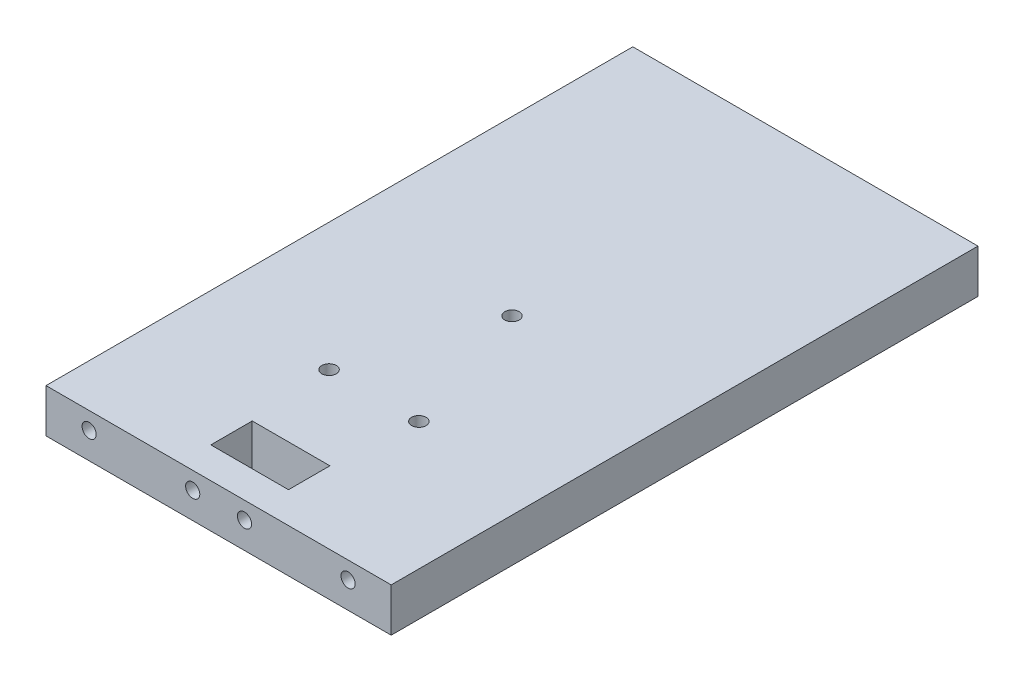
from build123d import *

# Parameters (mm, degrees)
SKETCH1_R           = 2.05
BOSS_EXTRUDE1_DEPTH = 170
BOSS_EXTRUDE3_START = 10
SKETCH1_3_R         = 2.05
BOSS_EXTRUDE3_DEPTH = 151
SKETCH3_R           = 2.1
SKETCH3_W           = 22.5
SKETCH3_H           = 12
CUT_EXTRUDE1_DEPTH  = 178.649984239


with BuildPart() as part:
    # Sketch1 → Boss-Extrude1 (new body)
    with BuildSketch(Plane.XY):
        Polygon((-50, 5), (50, 5), (50, -5), (50, -7.63), (-50, -7.63), (-50, -5), align=None)
        with Locations((-37.5, 0)):
            Circle(SKETCH1_R, mode=Mode.SUBTRACT)
        with Locations((-7.5, 0)):
            Circle(SKETCH1_R, mode=Mode.SUBTRACT)
        with Locations((7.5, 0)):
            Circle(SKETCH1_R, mode=Mode.SUBTRACT)
        with Locations((37.5, 0)):
            Circle(SKETCH1_R, mode=Mode.SUBTRACT)
    extrude(amount=BOSS_EXTRUDE1_DEPTH)

    # Sketch1<3> → Boss-Extrude3 (add)
    with BuildSketch(Plane.XY.offset(BOSS_EXTRUDE3_START)):
        with Locations((-37.5, 0)):
            Circle(SKETCH1_3_R)
        with Locations((-7.5, 0)):
            Circle(SKETCH1_3_R)
        with Locations((7.5, 0)):
            Circle(SKETCH1_3_R)
        with Locations((37.5, 0)):
            Circle(SKETCH1_3_R)
    extrude(amount=BOSS_EXTRUDE3_DEPTH)

    # Sketch3 → Cut-Extrude1 (cut, through all)
    with BuildSketch(Plane(origin=(0, 5, 0), x_dir=(1, 0, 0), z_dir=(0, 1, 0))):
        with Locations(Location((0, -85, 0), (0, 0, 270))):
            Circle(SKETCH3_R)
        with Locations(Location((13, -125, 0), (0, 0, 270))):
            Circle(SKETCH3_R)
        with Locations(Location((-13, -125, 0), (0, 0, 270))):
            Circle(SKETCH3_R)
        with Locations((0, -155)):
            Rectangle(SKETCH3_W, SKETCH3_H)
    extrude(amount=-CUT_EXTRUDE1_DEPTH, mode=Mode.SUBTRACT)


solid = part.part
